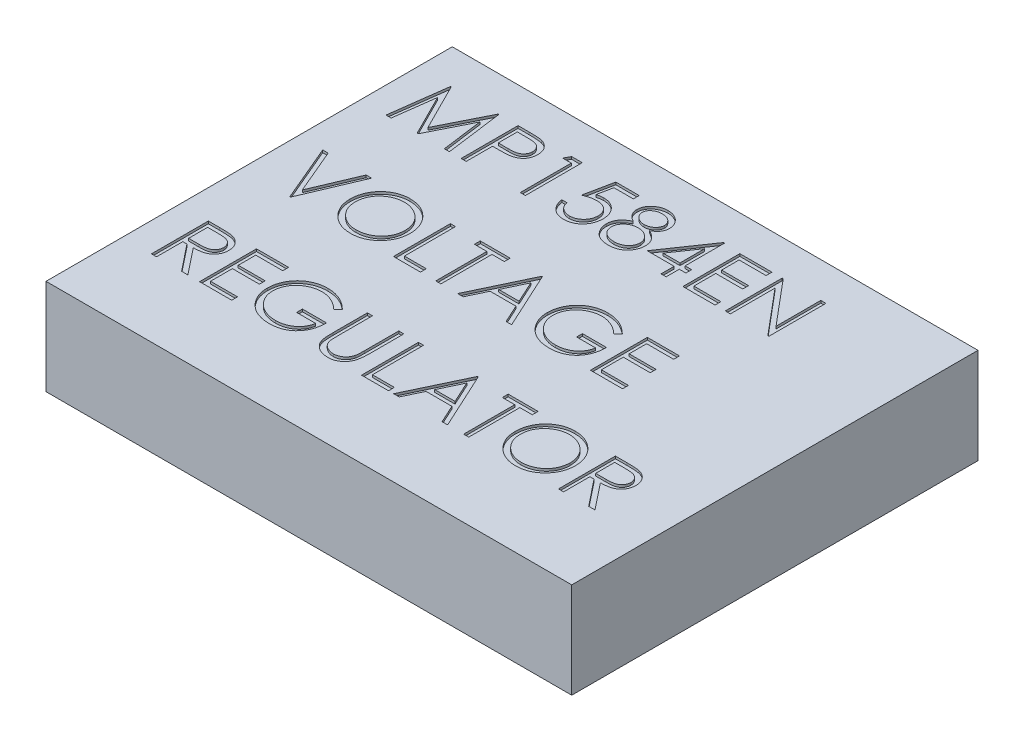
from build123d import *

# Parameters (mm, degrees)
SKETCH1_W           = 22
SKETCH1_H           = 17
BOSS_EXTRUDE1_DEPTH = 4
CUT_EXTRUDE1_DEPTH  = 0.1


with BuildPart() as part:
    # Sketch1 → Boss-Extrude1 (new body)
    with BuildSketch(Plane(origin=(0, 0, 0), x_dir=(1, 0, 0), z_dir=(0, 1, 0))):
        Rectangle(SKETCH1_W, SKETCH1_H)
    extrude(amount=BOSS_EXTRUDE1_DEPTH)

    # Sketch2 → Cut-Extrude1 (cut)
    # profile 1 of 24: a face of its own
    with BuildSketch(Plane(origin=(0, 4, 0), x_dir=(1, 0, 0), z_dir=(0, 1, 0))):
        Polygon((-9.911138642, 4.638266378), (-9.596786929, 7.019516378), (-9.566258083, 7.019516378), (-8.583133834, 5.065670224), (-7.602394651, 7.019516378), (-7.571388792, 7.019516378), (-7.255129026, 4.638266378), (-7.469784976, 4.638266378), (-7.697797296, 6.351697868), (-8.55737512, 4.638266378), (-8.605553455, 4.638266378), (-9.468470372, 6.355513974), (-9.696005679, 4.638266378), align=None)
    # profile 2 of 24: a face of its own
    with BuildSketch(Plane(origin=(0, 4, 0), x_dir=(1, 0, 0), z_dir=(0, 1, 0))):
        with BuildLine():
            Line((-6.766667488, 7.019516378), (-6.299671544, 7.019516378))
            add(Edge.make_bspline(
                [(-6.299671544, 7.019516378), (-6.267551267, 7.01948107), (-6.20600739, 7.019413418), (-6.117754825, 7.017362314), (-6.037602132, 7.014622726), (-5.965722141, 7.010825045), (-5.901893689, 7.006337007), (-5.846405597, 7.000042316), (-5.798821721, 6.993469865), (-5.770310368, 6.986787801), (-5.757307512, 6.983740386)],
                knots=[0, 0, 0, 0, 1.415646017, 2.712440637, 3.8905458, 4.950247383, 5.884950622, 6.709939814, 7.411656543, 8, 8, 8, 8], degree=3))
            add(Edge.make_bspline(
                [(-5.757307512, 6.983740386), (-5.740847268, 6.979235095), (-5.708314646, 6.970330675), (-5.66143733, 6.952495981), (-5.616837303, 6.931349008), (-5.574361546, 6.907248077), (-5.534532021, 6.879159149), (-5.496754483, 6.848220848), (-5.461362318, 6.81371887), (-5.428554549, 6.776040189), (-5.398425071, 6.735817331), (-5.372483269, 6.69244985), (-5.350761352, 6.646667731), (-5.332130948, 6.598502819), (-5.31872216, 6.547550653), (-5.308620966, 6.494165265), (-5.302209533, 6.438352377), (-5.301595469, 6.400211646), (-5.301282872, 6.380795675)],
                knots=[0, 0, 0, 0, 0.999701418, 1.975846123, 2.934577507, 3.890451536, 4.834027766, 5.787354733, 6.749476667, 7.726910423, 8.712836071, 9.690891519, 10.682875813, 11.679750201, 12.712814741, 13.765529915, 14.8625177, 16, 16, 16, 16], degree=3))
            add(Edge.make_bspline(
                [(-5.301282872, 6.380795675), (-5.301569592, 6.361216509), (-5.302130578, 6.322908548), (-5.308863586, 6.266865633), (-5.317932877, 6.213309014), (-5.331878193, 6.162357442), (-5.350142838, 6.114313498), (-5.371568682, 6.068442981), (-5.397411048, 6.025526276), (-5.427105119, 5.985407576), (-5.460137543, 5.948049225), (-5.49636856, 5.913721945), (-5.5356519, 5.882626672), (-5.577862719, 5.854693695), (-5.623412527, 5.830570762), (-5.671610492, 5.808964453), (-5.72287555, 5.790818606), (-5.758351082, 5.781273154), (-5.776388041, 5.776419923)],
                knots=[0, 0, 0, 0, 1.121902311, 2.195077645, 3.232258892, 4.234102512, 5.217864754, 6.176164875, 7.132989551, 8.084763148, 9.034132444, 9.988522005, 10.94243251, 11.903244335, 12.886203696, 13.894208494, 14.929344452, 16, 16, 16, 16], degree=3))
            add(Edge.make_bspline(
                [(-5.776388041, 5.776419923), (-5.791306459, 5.773247431), (-5.82400104, 5.766294729), (-5.877846356, 5.758532904), (-5.940538128, 5.751907858), (-6.011990786, 5.746940477), (-6.092140195, 5.742687994), (-6.181029711, 5.739307916), (-6.278833824, 5.73745064), (-6.347054081, 5.737354851), (-6.382671845, 5.737304839)],
                knots=[0, 0, 0, 0, 0.601384939, 1.31797006, 2.144135048, 3.087295005, 4.142315834, 5.309527816, 6.595305764, 8, 8, 8, 8], degree=3))
            Line((-6.382671845, 5.737304839), (-6.552965565, 5.737304839))
            Line((-6.552965565, 5.737304839), (-6.552965565, 4.638266378))
            Line((-6.552965565, 4.638266378), (-6.766667488, 4.638266378))
            Line((-6.766667488, 4.638266378), (-6.766667488, 7.019516378))
        make_face()
        with BuildLine():
            Line((-6.552965565, 6.775285608), (-6.552965565, 5.981535608))
            Line((-6.552965565, 5.981535608), (-6.136056009, 5.976288463))
            add(Edge.make_bspline(
                [(-6.136056009, 5.976288463), (-6.115699774, 5.976277942), (-6.076402482, 5.976257632), (-6.019636051, 5.978969007), (-5.96697009, 5.982099013), (-5.91856637, 5.986681846), (-5.874403071, 5.993159702), (-5.834406556, 5.999699116), (-5.798886958, 6.009159729), (-5.75731768, 6.021898103), (-5.710996688, 6.043623686), (-5.660604303, 6.075158165), (-5.617897886, 6.115354147), (-5.580942045, 6.160548796), (-5.551614653, 6.210826597), (-5.530145308, 6.264621713), (-5.517530699, 6.321382446), (-5.5158392, 6.360222769), (-5.514984796, 6.379841648)],
                knots=[0, 0, 0, 0, 1.160613943, 2.240541288, 3.23993089, 4.169200891, 5.011653406, 5.7853311, 6.478053781, 7.106038997, 8.262395093, 9.384106736, 10.481365981, 11.59014053, 12.70357646, 13.786202915, 14.881775077, 16, 16, 16, 16], degree=3))
            add(Edge.make_bspline(
                [(-5.514984796, 6.379841648), (-5.515843846, 6.398985887), (-5.517551532, 6.437042264), (-5.530244182, 6.492817099), (-5.551572912, 6.546045319), (-5.581138916, 6.595693079), (-5.617021721, 6.640725105), (-5.658727167, 6.679843686), (-5.706157082, 6.711290952), (-5.750277039, 6.731588238), (-5.789466417, 6.743981131), (-5.823506019, 6.752652174), (-5.861939853, 6.75957522), (-5.904780431, 6.765181025), (-5.951695706, 6.769979897), (-6.003088738, 6.773236071), (-6.058764841, 6.775142062), (-6.097416319, 6.775236601), (-6.117452494, 6.775285608)],
                knots=[0, 0, 0, 0, 1.120700087, 2.227813068, 3.331159281, 4.466773991, 5.599788987, 6.693661531, 7.80175334, 8.91857717, 9.525282508, 10.207424825, 10.974604443, 11.810962634, 12.737642355, 13.736264703, 14.826523623, 16, 16, 16, 16], degree=3))
            Line((-6.117452494, 6.775285608), (-6.552965565, 6.775285608))
        make_face(mode=Mode.SUBTRACT)
    # profile 3 of 24: a face of its own
    with BuildSketch(Plane(origin=(0, 4, 0), x_dir=(1, 0, 0), z_dir=(0, 1, 0))):
        Polygon((-4.520412229, 7.019516378), (-4.080129026, 7.019516378), (-4.080129026, 4.638266378), (-4.293830949, 4.638266378), (-4.293830949, 6.775285608), (-4.660177103, 6.775285608), align=None)
    # profile 4 of 24: a face of its own
    with BuildSketch(Plane(origin=(0, 4, 0), x_dir=(1, 0, 0), z_dir=(0, 1, 0))):
        with BuildLine():
            Line((-1.698879026, 7.019516378), (-1.698879026, 6.775285608))
            Line((-1.698879026, 6.775285608), (-2.508847476, 6.775285608))
            Line((-2.508847476, 6.775285608), (-2.637164032, 6.148967249))
            add(Edge.make_bspline(
                [(-2.637164032, 6.148967249), (-2.611952804, 6.155927488), (-2.563110035, 6.169411849), (-2.491019487, 6.184383632), (-2.422580863, 6.193408872), (-2.378170298, 6.19464121), (-2.356680258, 6.195237532)],
                knots=[0, 0, 0, 0, 1.100273476, 2.13160584, 3.095893838, 4, 4, 4, 4], degree=3))
            add(Edge.make_bspline(
                [(-2.356680258, 6.195237532), (-2.330089357, 6.194661993), (-2.277805001, 6.193530341), (-2.20130636, 6.182663779), (-2.128281659, 6.165559659), (-2.058883618, 6.141665161), (-1.992983851, 6.111110503), (-1.931188671, 6.072942508), (-1.872570519, 6.028356438), (-1.818181004, 5.977094921), (-1.768838573, 5.920678607), (-1.725454927, 5.860019412), (-1.688605021, 5.795706842), (-1.658968151, 5.727126428), (-1.63530238, 5.655036361), (-1.619550755, 5.578678122), (-1.609061887, 5.498771454), (-1.60789005, 5.444135667), (-1.607292488, 5.416274941)],
                knots=[0, 0, 0, 0, 1.052922333, 2.070308379, 3.05430497, 4.020497103, 4.973039431, 5.925935799, 6.892292201, 7.88610001, 8.88166317, 9.857072816, 10.836096531, 11.812156883, 12.81219415, 13.836441305, 14.89672472, 16, 16, 16, 16], degree=3))
            add(Edge.make_bspline(
                [(-1.607292488, 5.416274941), (-1.607744977, 5.396869645), (-1.608643839, 5.358321298), (-1.613214878, 5.30107319), (-1.622015785, 5.245037048), (-1.63383204, 5.190205439), (-1.649168935, 5.13668217), (-1.667735238, 5.084314041), (-1.690456464, 5.033426996), (-1.715378882, 4.98353954), (-1.743441218, 4.935779484), (-1.774586952, 4.891114727), (-1.807492759, 4.848875243), (-1.842899488, 4.809514042), (-1.881136236, 4.773289775), (-1.921739928, 4.739987462), (-1.964386564, 4.709043914), (-2.009735934, 4.681715195), (-2.056777516, 4.656567184), (-2.106190642, 4.635936349), (-2.156850512, 4.617491507), (-2.209486257, 4.602789311), (-2.263978655, 4.591269126), (-2.320417529, 4.583444611), (-2.378506878, 4.577745642), (-2.417882556, 4.577388892), (-2.437772506, 4.577208685)],
                knots=[0, 0, 0, 0, 1.056347294, 2.098418968, 3.122841568, 4.141288669, 5.149314143, 6.15115421, 7.162517403, 8.180376062, 9.185164535, 10.17417709, 11.141909838, 12.097768115, 13.052685741, 14.0056014, 14.954263652, 15.917497458, 16.885230207, 17.854509472, 18.828990115, 19.81800267, 20.826176721, 21.857883937, 22.917946725, 24, 24, 24, 24], degree=3))
            add(Edge.make_bspline(
                [(-2.437772506, 4.577208685), (-2.461499404, 4.577678702), (-2.508179273, 4.578603404), (-2.576569158, 4.588277052), (-2.642369631, 4.602131788), (-2.705051004, 4.622975393), (-2.765175024, 4.649092463), (-2.821932266, 4.682100787), (-2.876772981, 4.719506213), (-2.927467778, 4.763648025), (-2.974518634, 4.811896015), (-3.016637169, 4.864254696), (-3.054147692, 4.919859906), (-3.086449516, 4.978981686), (-3.114002634, 5.041464686), (-3.135648189, 5.107543014), (-3.153118641, 5.176871409), (-3.160509647, 5.224600851), (-3.164263642, 5.248843301)],
                knots=[0, 0, 0, 0, 1.0467383, 2.05933395, 3.04377827, 4.011590433, 4.970194871, 5.932262533, 6.905835911, 7.896367577, 8.894135286, 9.877477877, 10.858688626, 11.851381753, 12.8477658, 13.868841284, 14.917554742, 16, 16, 16, 16], degree=3))
            Line((-3.164263642, 5.248843301), (-2.950561719, 5.248843301))
            add(Edge.make_bspline(
                [(-2.950561719, 5.248843301), (-2.945303539, 5.226135393), (-2.935197027, 5.182489533), (-2.913013473, 5.121168031), (-2.88589044, 5.066522274), (-2.853638553, 5.017829397), (-2.815164336, 4.97536899), (-2.771261278, 4.937529524), (-2.722038987, 4.903392517), (-2.667342879, 4.874938098), (-2.609639695, 4.850670607), (-2.54924629, 4.834510972), (-2.487807083, 4.8231484), (-2.446251977, 4.822011006), (-2.425370162, 4.821439455)],
                knots=[0, 0, 0, 0, 1.136247022, 2.183929868, 3.172523383, 4.106158343, 5.02341133, 5.958108904, 6.928429099, 7.938127109, 8.96079061, 9.975095812, 10.982467395, 12, 12, 12, 12], degree=3))
            add(Edge.make_bspline(
                [(-2.425370162, 4.821439455), (-2.40498772, 4.821997877), (-2.364854526, 4.823097414), (-2.305791779, 4.831560385), (-2.248769091, 4.844594376), (-2.194349122, 4.864100116), (-2.141579574, 4.887806969), (-2.091795277, 4.918229191), (-2.043555998, 4.953240382), (-1.998361143, 4.993351946), (-1.956968589, 5.037554542), (-1.920395228, 5.084823983), (-1.889930935, 5.135249909), (-1.864258265, 5.187959322), (-1.844763788, 5.243529911), (-1.830856621, 5.301701247), (-1.822690254, 5.36261701), (-1.821566862, 5.404165951), (-1.820994411, 5.425338193)],
                knots=[0, 0, 0, 0, 1.027316725, 2.022795036, 3.002884548, 3.971462791, 4.93288096, 5.914575861, 6.907176829, 7.935150275, 8.956128384, 9.956726525, 10.942570165, 11.921478529, 12.907843606, 13.90538589, 14.932640048, 16, 16, 16, 16], degree=3))
            add(Edge.make_bspline(
                [(-1.820994411, 5.425338193), (-1.821442412, 5.444439731), (-1.822319311, 5.481828274), (-1.829483859, 5.536528448), (-1.841945942, 5.588285286), (-1.859243261, 5.63734872), (-1.881204854, 5.683765026), (-1.908042435, 5.727582108), (-1.940259657, 5.768222449), (-1.97706146, 5.805705061), (-2.017378091, 5.840297735), (-2.061903209, 5.869787194), (-2.109705052, 5.89459568), (-2.16020769, 5.916005158), (-2.21461238, 5.931381736), (-2.271841732, 5.942925958), (-2.332513742, 5.949603911), (-2.373995586, 5.950530481), (-2.395318329, 5.951006762)],
                knots=[0, 0, 0, 0, 1.045622112, 2.046656509, 3.013763289, 3.955457236, 4.890082067, 5.820317437, 6.762574623, 7.722996705, 8.69280354, 9.665887285, 10.63943826, 11.638615906, 12.663482002, 13.728887084, 14.832589034, 16, 16, 16, 16], degree=3))
            add(Edge.make_bspline(
                [(-2.395318329, 5.951006762), (-2.41377569, 5.950611753), (-2.451885456, 5.949796159), (-2.510343665, 5.943790989), (-2.571774284, 5.934103183), (-2.635941825, 5.92077754), (-2.703038992, 5.903339254), (-2.772924189, 5.882442424), (-2.845744357, 5.85745835), (-2.894810166, 5.83859054), (-2.920032872, 5.828891378)],
                knots=[0, 0, 0, 0, 0.817624296, 1.688186739, 2.600797293, 3.572016777, 4.590301741, 5.671205678, 6.80286297, 8, 8, 8, 8], degree=3))
            Line((-2.920032872, 5.828891378), (-2.675802103, 7.019516378))
            Line((-2.675802103, 7.019516378), (-1.698879026, 7.019516378))
        make_face()
    # profile 5 of 24: a face of its own
    with BuildSketch(Plane(origin=(0, 4, 0), x_dir=(1, 0, 0), z_dir=(0, 1, 0))):
        with BuildLine():
            add(Edge.make_bspline(
                [(-0.205350631, 5.964840146), (-0.185859387, 5.954677001), (-0.147844953, 5.934855474), (-0.093704031, 5.902939357), (-0.044225056, 5.869301843), (0.001964772, 5.835531732), (0.044053945, 5.800335733), (0.08157184, 5.76357389), (0.115445203, 5.726163809), (0.144990925, 5.687472007), (0.170978416, 5.647601276), (0.193438458, 5.606446967), (0.212636234, 5.56409927), (0.227851019, 5.520095927), (0.240384416, 5.475083321), (0.249008355, 5.428480229), (0.253646293, 5.38059374), (0.254523147, 5.348230306), (0.254967128, 5.331843601)],
                knots=[0, 0, 0, 0, 1.272397273, 2.481599622, 3.635517121, 4.734568067, 5.792894095, 6.808321871, 7.773003508, 8.711915296, 9.623354172, 10.525449501, 11.423591555, 12.311487226, 13.218079475, 14.126165749, 15.051214107, 16, 16, 16, 16], degree=3))
            add(Edge.make_bspline(
                [(0.254967128, 5.331843601), (0.254442286, 5.308917108), (0.253403428, 5.263536976), (0.244354689, 5.196558461), (0.230806752, 5.131508302), (0.211022298, 5.068400761), (0.185363723, 5.007584062), (0.153742876, 4.949006147), (0.117948466, 4.891706938), (0.089201854, 4.856451238), (0.07465613, 4.838611931)],
                knots=[0, 0, 0, 0, 1.025265484, 2.029385089, 3.018602448, 3.995076438, 4.983346944, 5.966715145, 6.97116228, 8, 8, 8, 8], degree=3))
            add(Edge.make_bspline(
                [(0.07465613, 4.838611931), (0.055717386, 4.817797238), (0.018073929, 4.776425065), (-0.046412313, 4.722710318), (-0.117184345, 4.677569033), (-0.193968317, 4.640780834), (-0.276558981, 4.612147419), (-0.364938738, 4.591571706), (-0.459279885, 4.579786267), (-0.524121643, 4.57808266), (-0.557386388, 4.577208685)],
                knots=[0, 0, 0, 0, 0.954267603, 1.896743057, 2.838368354, 3.796610408, 4.779680527, 5.799409237, 6.871065594, 8, 8, 8, 8], degree=3))
            add(Edge.make_bspline(
                [(-0.557386388, 4.577208685), (-0.589372283, 4.577992782), (-0.651613585, 4.579518554), (-0.742208498, 4.589856194), (-0.826656515, 4.607972654), (-0.905448655, 4.632768004), (-0.978109908, 4.665023891), (-1.044433233, 4.705170684), (-1.105375524, 4.751592433), (-1.159087322, 4.805622368), (-1.206772495, 4.863492099), (-1.24866076, 4.923194534), (-1.28347741, 4.984735122), (-1.312955308, 5.047196239), (-1.33552141, 5.111453355), (-1.351150717, 5.177175864), (-1.361076661, 5.24424897), (-1.362397326, 5.289514255), (-1.363061719, 5.312286059)],
                knots=[0, 0, 0, 0, 1.256902934, 2.445805442, 3.576955095, 4.645999104, 5.686449165, 6.692658513, 7.68621702, 8.689161843, 9.678783111, 10.630372946, 11.551080876, 12.453998257, 13.34127905, 14.221779781, 15.105423033, 16, 16, 16, 16], degree=3))
            add(Edge.make_bspline(
                [(-1.363061719, 5.312286059), (-1.362668553, 5.328995081), (-1.361891519, 5.362018005), (-1.356513399, 5.410805959), (-1.347867107, 5.458292258), (-1.336124512, 5.5046523), (-1.32021026, 5.549548573), (-1.300995523, 5.593193806), (-1.278590034, 5.635637273), (-1.252681242, 5.677111083), (-1.222540043, 5.717034108), (-1.188410846, 5.756083883), (-1.149611528, 5.793654475), (-1.106573728, 5.830204911), (-1.059789282, 5.866383564), (-1.008042998, 5.90023523), (-0.952706648, 5.934156452), (-0.913378327, 5.954436759), (-0.893203696, 5.964840146)],
                knots=[0, 0, 0, 0, 0.941657376, 1.861047343, 2.762797495, 3.66048619, 4.553285746, 5.444104102, 6.34607688, 7.256116206, 8.197091036, 9.162375105, 10.176350973, 11.237807142, 12.343728897, 13.50695164, 14.721116704, 16, 16, 16, 16], degree=3))
            add(Edge.make_bspline(
                [(-0.893203696, 5.964840146), (-0.920820327, 5.979899694), (-0.974293856, 6.009059194), (-1.045098244, 6.062635146), (-1.105915793, 6.12066132), (-1.155074806, 6.184363019), (-1.193768233, 6.251750268), (-1.220314819, 6.322401447), (-1.238273856, 6.395006517), (-1.240052872, 6.444608768), (-1.240946334, 6.469520134)],
                knots=[0, 0, 0, 0, 1.166880483, 2.259407225, 3.286803203, 4.280235371, 5.237608625, 6.161067461, 7.076446754, 8, 8, 8, 8], degree=3))
            add(Edge.make_bspline(
                [(-1.240946334, 6.469520134), (-1.239833662, 6.494895794), (-1.237596996, 6.545905297), (-1.219510844, 6.62183732), (-1.190037727, 6.696415733), (-1.149950406, 6.769279066), (-1.100020889, 6.837961266), (-1.040117793, 6.899561445), (-0.971671621, 6.953521579), (-0.895024037, 6.998817153), (-0.812540098, 7.035681393), (-0.725511721, 7.06111207), (-0.635455232, 7.077737356), (-0.574156605, 7.079619669), (-0.543075991, 7.08057407)],
                knots=[0, 0, 0, 0, 0.888701115, 1.786444228, 2.72001202, 3.692817113, 4.693886446, 5.687152267, 6.695133018, 7.739871481, 8.800368666, 9.853104506, 10.91144658, 12, 12, 12, 12], degree=3))
            add(Edge.make_bspline(
                [(-0.543075991, 7.08057407), (-0.512797503, 7.07959004), (-0.453091773, 7.077649645), (-0.365329357, 7.061466073), (-0.28135636, 7.03443581), (-0.201462362, 6.99776645), (-0.127077645, 6.95259962), (-0.061353574, 6.897898311), (-0.003296942, 6.836569863), (0.044725655, 6.76790849), (0.084297192, 6.695325137), (0.111852269, 6.619381958), (0.12950888, 6.54171983), (0.131735937, 6.489170403), (0.132851743, 6.462841949)],
                knots=[0, 0, 0, 0, 1.072916533, 2.115669174, 3.151510826, 4.193348718, 5.225979165, 6.227137561, 7.216255879, 8.211077061, 9.189680878, 10.138522389, 11.067357538, 12, 12, 12, 12], degree=3))
            add(Edge.make_bspline(
                [(0.132851743, 6.462841949), (0.131875729, 6.437004254), (0.129958894, 6.386260491), (0.113834471, 6.312287626), (0.086679163, 6.243012274), (0.04960367, 6.177648355), (0.001280972, 6.1173813), (-0.057643898, 6.061444738), (-0.126701154, 6.009379164), (-0.178585792, 5.979997012), (-0.205350631, 5.964840146)],
                knots=[0, 0, 0, 0, 0.975232327, 1.915300861, 2.843280834, 3.77672583, 4.742871857, 5.749627742, 6.839139064, 8, 8, 8, 8], degree=3))
        make_face()
        with BuildLine():
            add(Edge.make_bspline(
                [(-0.555001322, 6.836343301), (-0.571704638, 6.835900089), (-0.604383628, 6.835032972), (-0.652300277, 6.83050272), (-0.697865406, 6.821689907), (-0.741555085, 6.809961426), (-0.782770312, 6.794117277), (-0.82207084, 6.775478887), (-0.858787803, 6.752818867), (-0.893364439, 6.72739991), (-0.924491305, 6.699442057), (-0.952116902, 6.670313438), (-0.975064065, 6.639441966), (-0.994550249, 6.607595564), (-1.008689103, 6.573829047), (-1.019278388, 6.539177657), (-1.026436692, 6.503203512), (-1.026973079, 6.478617779), (-1.027244411, 6.466181041)],
                knots=[0, 0, 0, 0, 1.203892937, 2.355340988, 3.463153438, 4.544400666, 5.610487187, 6.640501085, 7.674077295, 8.714426146, 9.728707835, 10.68524104, 11.601827946, 12.495867327, 13.368432065, 14.231010473, 15.105153427, 16, 16, 16, 16], degree=3))
            add(Edge.make_bspline(
                [(-1.027244411, 6.466181041), (-1.026776756, 6.453743766), (-1.025852602, 6.429165923), (-1.018705364, 6.392871682), (-1.008053111, 6.357206247), (-0.991281857, 6.323017681), (-0.971166174, 6.289120003), (-0.946338938, 6.256360408), (-0.916750867, 6.224624887), (-0.883394698, 6.194183367), (-0.847055776, 6.165677244), (-0.808558418, 6.140930491), (-0.768385784, 6.120224426), (-0.726950626, 6.102991385), (-0.683830647, 6.089595195), (-0.639290064, 6.080091527), (-0.593321392, 6.074184668), (-0.562174247, 6.073479123), (-0.546415084, 6.073122147)],
                knots=[0, 0, 0, 0, 0.873023192, 1.725219244, 2.590779336, 3.480155217, 4.391973325, 5.357036234, 6.360879153, 7.436073238, 8.526419356, 9.601555421, 10.645666583, 11.697338044, 12.750135903, 13.812665442, 14.89329948, 16, 16, 16, 16], degree=3))
            add(Edge.make_bspline(
                [(-0.546415084, 6.073122147), (-0.526174388, 6.073716008), (-0.485892913, 6.074897866), (-0.426511797, 6.085886432), (-0.36877489, 6.10317153), (-0.313299314, 6.126820721), (-0.261521016, 6.156503247), (-0.215365541, 6.192040354), (-0.175226584, 6.232611477), (-0.141521276, 6.277585014), (-0.115388862, 6.325449219), (-0.095044954, 6.373482633), (-0.083165091, 6.422197722), (-0.081615532, 6.454832389), (-0.08085018, 6.470951173)],
                knots=[0, 0, 0, 0, 1.076279235, 2.141928126, 3.20205304, 4.278698113, 5.344010996, 6.36967002, 7.368914609, 8.37248503, 9.349703398, 10.264243087, 11.142681841, 12, 12, 12, 12], degree=3))
            add(Edge.make_bspline(
                [(-0.08085018, 6.470951173), (-0.08121206, 6.482264176), (-0.081930341, 6.504718866), (-0.087849486, 6.537878361), (-0.097630187, 6.570283488), (-0.110872032, 6.602201947), (-0.128295839, 6.63318591), (-0.148954331, 6.663722439), (-0.174048965, 6.693124593), (-0.202213324, 6.722077564), (-0.234152968, 6.748872766), (-0.269806344, 6.772436739), (-0.308990664, 6.792447645), (-0.351706853, 6.80870053), (-0.397797596, 6.820907736), (-0.447050605, 6.830049251), (-0.499876559, 6.835201672), (-0.536227872, 6.835954504), (-0.555001322, 6.836343301)],
                knots=[0, 0, 0, 0, 0.814439003, 1.616544685, 2.417341072, 3.248991801, 4.09997495, 4.973547432, 5.9003056, 6.880240646, 7.880314356, 8.896779544, 9.951930927, 11.043077905, 12.18215768, 13.381699519, 14.647792085, 16, 16, 16, 16], degree=3))
        make_face(mode=Mode.SUBTRACT)
        with BuildLine():
            add(Edge.make_bspline(
                [(-0.541167939, 5.828891378), (-0.562344589, 5.828514704), (-0.60388801, 5.827775762), (-0.66475067, 5.819550584), (-0.723161485, 5.808100586), (-0.778923513, 5.790730498), (-0.832013207, 5.768145028), (-0.882717968, 5.740975279), (-0.930649897, 5.708858718), (-0.975147109, 5.672203378), (-1.015780303, 5.632702214), (-1.051429861, 5.590886011), (-1.081704067, 5.547531931), (-1.106083475, 5.502089361), (-1.126093957, 5.45552054), (-1.139234291, 5.406665729), (-1.147658277, 5.35646414), (-1.14878946, 5.322337359), (-1.149359796, 5.305130861)],
                knots=[0, 0, 0, 0, 1.140299081, 2.23698856, 3.303958914, 4.344563908, 5.37730929, 6.408454204, 7.439741482, 8.480804886, 9.510774543, 10.48932336, 11.43758569, 12.353841022, 13.263987381, 14.161954604, 15.073269652, 16, 16, 16, 16], degree=3))
            add(Edge.make_bspline(
                [(-1.149359796, 5.305130861), (-1.148432293, 5.283746619), (-1.146592149, 5.241320784), (-1.131993971, 5.17861698), (-1.108565509, 5.117914798), (-1.07589121, 5.059708916), (-1.035432022, 5.00531429), (-0.985679907, 4.957901034), (-0.929726766, 4.915772314), (-0.865679405, 4.881699665), (-0.795719323, 4.85448888), (-0.719865129, 4.835740984), (-0.639205443, 4.823330283), (-0.583511685, 4.822079663), (-0.555001322, 4.821439455)],
                knots=[0, 0, 0, 0, 0.898778495, 1.783155532, 2.693654817, 3.627872908, 4.583023416, 5.533784346, 6.509005473, 7.520592997, 8.575161974, 9.658835044, 10.801527049, 12, 12, 12, 12], degree=3))
            add(Edge.make_bspline(
                [(-0.555001322, 4.821439455), (-0.532719375, 4.821867269), (-0.489306998, 4.822700788), (-0.425975307, 4.830058371), (-0.366209641, 4.84172624), (-0.310125898, 4.85869676), (-0.25709625, 4.879413619), (-0.208019807, 4.906064624), (-0.161634059, 4.936376116), (-0.120224719, 4.97233854), (-0.082510339, 5.010764768), (-0.049626438, 5.051443351), (-0.021080319, 5.093268736), (0.001324492, 5.13718612), (0.019235747, 5.182352931), (0.032110523, 5.229185663), (0.040054519, 5.277827955), (0.04085795, 5.310824645), (0.041265204, 5.327550482)],
                knots=[0, 0, 0, 0, 1.224942928, 2.386581632, 3.501229538, 4.569074225, 5.605009692, 6.626002462, 7.634866581, 8.645888296, 9.63523824, 10.59253846, 11.518950513, 12.414518923, 13.29783783, 14.186679152, 15.080837789, 16, 16, 16, 16], degree=3))
            add(Edge.make_bspline(
                [(0.041265204, 5.327550482), (0.040648904, 5.343795602), (0.039433667, 5.375828139), (0.031720668, 5.423294294), (0.018170759, 5.46915228), (-0.000421631, 5.513953802), (-0.025173679, 5.556791095), (-0.054323492, 5.598780133), (-0.089493955, 5.6387555), (-0.129235382, 5.677027695), (-0.172546211, 5.712416973), (-0.218584036, 5.743723225), (-0.266994482, 5.770088504), (-0.31767511, 5.791530977), (-0.370513384, 5.808395309), (-0.425470443, 5.82017637), (-0.482610628, 5.827591993), (-0.521428317, 5.828453356), (-0.541167939, 5.828891378)],
                knots=[0, 0, 0, 0, 0.917430815, 1.809013306, 2.70690318, 3.612392954, 4.541220862, 5.495268465, 6.494511384, 7.542276156, 8.608045339, 9.649016899, 10.681629292, 11.715607085, 12.752076957, 13.808767841, 14.885711793, 16, 16, 16, 16], degree=3))
        make_face(mode=Mode.SUBTRACT)
    # profile 6 of 24: a face of its own
    with BuildSketch(Plane(origin=(0, 4, 0), x_dir=(1, 0, 0), z_dir=(0, 1, 0))):
        Polygon((1.768530078, 7.08057407), (1.811938281, 7.08057407), (1.811938281, 5.432016378), (2.086697897, 5.432016378), (2.086697897, 5.187785608), (1.811938281, 5.187785608), (1.811938281, 4.638266378), (1.598236358, 4.638266378), (1.598236358, 5.187785608), (0.468669051, 5.187785608), align=None)
        Polygon((1.598236358, 5.432016378), (1.598236358, 6.466181041), (0.888440685, 5.432016378), align=None, mode=Mode.SUBTRACT)
    # profile 7 of 24: a face of its own
    with BuildSketch(Plane(origin=(0, 4, 0), x_dir=(1, 0, 0), z_dir=(0, 1, 0))):
        Polygon((2.514101743, 7.019516378), (3.857370974, 7.019516378), (3.857370974, 6.775285608), (2.727803666, 6.775285608), (2.727803666, 6.042593301), (3.857370974, 6.042593301), (3.857370974, 5.798362532), (2.727803666, 5.798362532), (2.727803666, 4.882497147), (3.857370974, 4.882497147), (3.857370974, 4.638266378), (2.514101743, 4.638266378), align=None)
    # profile 8 of 24: a face of its own
    with BuildSketch(Plane(origin=(0, 4, 0), x_dir=(1, 0, 0), z_dir=(0, 1, 0))):
        Polygon((4.28477482, 4.638266378), (4.28477482, 7.019516378), (4.329614063, 7.019516378), (5.902803666, 5.145331432), (5.902803666, 7.019516378), (6.116505589, 7.019516378), (6.116505589, 4.638266378), (6.067850241, 4.638266378), (4.498476743, 6.508158205), (4.498476743, 4.638266378), align=None)
    # profile 9 of 24: a face of its own
    with BuildSketch(Plane(origin=(0, 4, 0), x_dir=(1, 0, 0), z_dir=(0, 1, 0))):
        Polygon((-9.972196334, 2.050766378), (-9.743229988, 2.050766378), (-8.949479988, 0.174196366), (-8.155729988, 2.050766378), (-7.926763642, 2.050766378), (-8.934215565, -0.330483622), (-8.964744411, -0.330483622), align=None)
    # profile 10 of 24: a face of its own
    with BuildSketch(Plane(origin=(0, 4, 0), x_dir=(1, 0, 0), z_dir=(0, 1, 0))):
        with BuildLine():
            add(Edge.make_bspline(
                [(-6.385056911, 2.11182407), (-6.340964253, 2.110707278), (-6.254362635, 2.108513806), (-6.127084893, 2.091723201), (-6.005576444, 2.062675088), (-5.888847474, 2.023987952), (-5.778294217, 1.972379879), (-5.673084542, 1.910001233), (-5.573468776, 1.8361985), (-5.480789586, 1.751542186), (-5.39597834, 1.659433086), (-5.321257513, 1.561136508), (-5.258635881, 1.457246787), (-5.207210551, 1.348076115), (-5.166866319, 1.233871387), (-5.139026755, 1.114023753), (-5.121243478, 0.989309737), (-5.119164458, 0.904246817), (-5.118109796, 0.861095404)],
                knots=[0, 0, 0, 0, 1.065120563, 2.091984664, 3.0946048, 4.079830382, 5.057816894, 6.036188127, 7.030412546, 8.04752943, 9.064399622, 10.05169764, 11.02544977, 11.989514704, 12.962713494, 13.945757189, 14.957906945, 16, 16, 16, 16], degree=3))
            add(Edge.make_bspline(
                [(-5.118109796, 0.861095404), (-5.119164303, 0.818261856), (-5.12124286, 0.73383197), (-5.139046975, 0.609909377), (-5.166969512, 0.490785171), (-5.2068359, 0.376658217), (-5.258016092, 0.267408125), (-5.3210547, 0.163322358), (-5.395309702, 0.064366794), (-5.47981472, -0.028374501), (-5.571935786, -0.113417423), (-5.670744236, -0.187521158), (-5.774017905, -0.251287036), (-5.88308576, -0.302166643), (-5.996501321, -0.342832896), (-6.115279651, -0.370559239), (-6.238864182, -0.388443816), (-6.323140704, -0.390497485), (-6.365976382, -0.391541315)],
                knots=[0, 0, 0, 0, 1.043624062, 2.057103931, 3.04512605, 4.022047818, 4.998200453, 5.980619268, 6.982898556, 8.009068085, 9.034988726, 10.034168286, 11.015286542, 11.987931943, 12.962482838, 13.94673481, 14.956375938, 16, 16, 16, 16], degree=3))
            add(Edge.make_bspline(
                [(-6.365976382, -0.391541315), (-6.409127571, -0.390487178), (-6.49419005, -0.388409195), (-6.619060783, -0.370596489), (-6.738992605, -0.34274178), (-6.853642547, -0.302934468), (-6.963074544, -0.251487745), (-7.067502618, -0.188755837), (-7.166507609, -0.114319907), (-7.25926869, -0.029842291), (-7.344142699, 0.06212264), (-7.418137917, 0.16066166), (-7.480883931, 0.263841533), (-7.532157913, 0.371948599), (-7.572751054, 0.484460241), (-7.600444868, 0.602126973), (-7.618362721, 0.724277958), (-7.6204275, 0.807446787), (-7.62147518, 0.849647087)],
                knots=[0, 0, 0, 0, 1.053102029, 2.075944431, 3.073151272, 4.055350789, 5.033113405, 6.020478099, 7.024410459, 8.052272461, 9.079885166, 10.07527673, 11.055994387, 12.023226415, 12.992069828, 13.970394897, 14.97016774, 16, 16, 16, 16], degree=3))
            add(Edge.make_bspline(
                [(-7.62147518, 0.849647087), (-7.621111437, 0.877972171), (-7.62038854, 0.934265005), (-7.61168562, 1.017858174), (-7.599057034, 1.100106996), (-7.580958233, 1.180777588), (-7.557287474, 1.259672472), (-7.529357434, 1.337335759), (-7.495244432, 1.412980399), (-7.456681348, 1.486964743), (-7.413640725, 1.558135479), (-7.36610026, 1.625408909), (-7.315729768, 1.689349552), (-7.260509674, 1.74830046), (-7.202259914, 1.803976572), (-7.140035553, 1.855522278), (-7.074216276, 1.903402379), (-7.004518871, 1.946550861), (-6.932660723, 1.985575558), (-6.85858563, 2.019063995), (-6.783299641, 2.047806405), (-6.706450139, 2.071102395), (-6.6282412, 2.089493834), (-6.548502129, 2.102017409), (-6.467296451, 2.110742525), (-6.412588036, 2.111462004), (-6.385056911, 2.11182407)],
                knots=[0, 0, 0, 0, 1.037015668, 2.060948919, 3.074880161, 4.083647147, 5.086022904, 6.090072063, 7.104153813, 8.122640571, 9.144368836, 10.147691507, 11.138137339, 12.123020368, 13.103399296, 14.087645067, 15.080126199, 16.082011238, 17.087798457, 18.072939717, 19.057185487, 20.037253025, 21.01195951, 21.997135196, 22.992090687, 24, 24, 24, 24], degree=3))
        make_face()
        with BuildLine():
            add(Edge.make_bspline(
                [(-6.37456262, 1.867593301), (-6.397160433, 1.867317831), (-6.442140023, 1.866769524), (-6.509008609, 1.859547046), (-6.574997764, 1.849253318), (-6.640121116, 1.834570177), (-6.704106181, 1.814564919), (-6.767549376, 1.791541016), (-6.829872168, 1.763495952), (-6.890868811, 1.73180988), (-6.950002103, 1.696738204), (-7.00580003, 1.657977055), (-7.058407043, 1.616435432), (-7.107694337, 1.572016385), (-7.153517188, 1.52449371), (-7.196777494, 1.474587856), (-7.235741263, 1.420872373), (-7.2714502, 1.364803864), (-7.303405106, 1.306455359), (-7.331820463, 1.24644115), (-7.355064191, 1.184271688), (-7.374020557, 1.120621448), (-7.389736679, 1.055591239), (-7.399692973, 0.988687742), (-7.406994811, 0.920247139), (-7.407511777, 0.873995199), (-7.407773257, 0.850601113)],
                knots=[0, 0, 0, 0, 1.008559885, 2.007477868, 2.99961109, 3.989939068, 4.984837346, 5.991145699, 7.001802488, 8.033829008, 9.059044045, 10.069351652, 11.065060232, 12.050310815, 13.029377138, 14.011219647, 14.996725999, 15.989392538, 16.977580475, 17.965360261, 18.951710183, 19.937753436, 20.929683414, 21.935841486, 22.955955122, 24, 24, 24, 24], degree=3))
            add(Edge.make_bspline(
                [(-7.407773257, 0.850601113), (-7.406905896, 0.816200745), (-7.405199527, 0.748524579), (-7.390260538, 0.649350181), (-7.367249516, 0.554040115), (-7.3333287, 0.463115887), (-7.290908014, 0.375795938), (-7.238502219, 0.292854888), (-7.176413449, 0.214270322), (-7.105885228, 0.140590862), (-7.028785315, 0.073340413), (-6.946916083, 0.014310308), (-6.86115461, -0.03563488), (-6.771277253, -0.076323688), (-6.677763838, -0.108565634), (-6.58001179, -0.130662703), (-6.478672281, -0.145205647), (-6.409595174, -0.146602254), (-6.37456262, -0.147310545)],
                knots=[0, 0, 0, 0, 1.032063989, 2.030389145, 3.003944642, 3.970395727, 4.937377036, 5.913328081, 6.909231446, 7.93887556, 8.970685674, 9.976071282, 10.964166581, 11.944589148, 12.933237628, 13.927779006, 14.949070134, 16, 16, 16, 16], degree=3))
            add(Edge.make_bspline(
                [(-6.37456262, -0.147310545), (-6.351015798, -0.146987033), (-6.304315379, -0.14634541), (-6.234853961, -0.139882917), (-6.166643931, -0.129519806), (-6.099780962, -0.114599128), (-6.034340939, -0.095925225), (-5.970050725, -0.073740324), (-5.907595102, -0.046062576), (-5.846186177, -0.015481917), (-5.787405877, 0.019379691), (-5.731293059, 0.056825289), (-5.67926208, 0.098305725), (-5.630011658, 0.142064809), (-5.584000677, 0.188984855), (-5.541540279, 0.239004863), (-5.502773439, 0.29244056), (-5.467078061, 0.348424024), (-5.435235127, 0.406932189), (-5.407490776, 0.467163987), (-5.383953061, 0.528971106), (-5.364951704, 0.592442694), (-5.350061773, 0.6574582), (-5.339802042, 0.724104678), (-5.332625337, 0.792248802), (-5.3320844, 0.838338818), (-5.331811719, 0.861572417)],
                knots=[0, 0, 0, 0, 1.047197238, 2.076906641, 3.100256066, 4.114471768, 5.12198147, 6.126382909, 7.136867548, 8.15857795, 9.17633901, 10.174870724, 11.156907918, 12.133735059, 13.104061851, 14.077631395, 15.04955518, 16.038496417, 17.029181396, 18.010275684, 18.986308667, 19.968651475, 20.955262928, 21.950658345, 22.966943676, 24, 24, 24, 24], degree=3))
            add(Edge.make_bspline(
                [(-5.331811719, 0.861572417), (-5.332084619, 0.884647073), (-5.332625966, 0.930419903), (-5.339798614, 0.998088781), (-5.350072613, 1.064255698), (-5.364879027, 1.128660893), (-5.383963149, 1.191320782), (-5.407494886, 1.252176516), (-5.435243456, 1.311454806), (-5.467089766, 1.36900914), (-5.502887317, 1.424236953), (-5.542003936, 1.477034308), (-5.585115004, 1.526409691), (-5.630988781, 1.573582046), (-5.680771116, 1.617545288), (-5.734236502, 1.658314003), (-5.790735861, 1.69687207), (-5.850557784, 1.731655711), (-5.912296081, 1.763778252), (-5.975646827, 1.791299381), (-6.03989234, 1.814684698), (-6.104869245, 1.834630704), (-6.171124449, 1.849195811), (-6.238210269, 1.859556323), (-6.306033887, 1.866767011), (-6.351647221, 1.867316997), (-6.37456262, 1.867593301)],
                knots=[0, 0, 0, 0, 1.02996197, 2.043119294, 3.035359645, 4.018872909, 4.991431989, 5.957985074, 6.929999688, 7.912076566, 8.892894881, 9.867085534, 10.843653904, 11.817741046, 12.803660682, 13.806313499, 14.818574707, 15.856120519, 16.894564902, 17.924820532, 18.937903209, 19.946497019, 20.957711757, 21.963978472, 22.977135795, 24, 24, 24, 24], degree=3))
        make_face(mode=Mode.SUBTRACT)
    # profile 11 of 24: a face of its own
    with BuildSketch(Plane(origin=(0, 4, 0), x_dir=(1, 0, 0), z_dir=(0, 1, 0))):
        Polygon((-4.629648257, 2.050766378), (-4.415946334, 2.050766378), (-4.415946334, -0.086252853), (-3.500080949, -0.086252853), (-3.500080949, -0.330483622), (-4.629648257, -0.330483622), align=None)
    # profile 12 of 24: a face of its own
    with BuildSketch(Plane(origin=(0, 4, 0), x_dir=(1, 0, 0), z_dir=(0, 1, 0))):
        Polygon((-3.377965565, 1.806535608), (-3.377965565, 2.050766378), (-2.126282872, 2.050766378), (-2.126282872, 1.806535608), (-2.645273257, 1.806535608), (-2.645273257, -0.330483622), (-2.85897518, -0.330483622), (-2.85897518, 1.806535608), align=None)
    # profile 13 of 24: a face of its own
    with BuildSketch(Plane(origin=(0, 4, 0), x_dir=(1, 0, 0), z_dir=(0, 1, 0))):
        Polygon((-0.783013642, 2.050766378), (0.31602482, -0.330483622), (0.083719381, -0.330483622), (-0.268316376, 0.432737532), (-1.347797296, 0.432737532), (-1.70985033, -0.330483622), (-1.943109796, -0.330483622), (-0.813542488, 2.050766378), align=None)
        Polygon((-0.800663131, 1.586632514), (-1.231883083, 0.676968301), (-0.380891496, 0.676968301), align=None, mode=Mode.SUBTRACT)
    # profile 14 of 24: a face of its own
    with BuildSketch(Plane(origin=(0, 4, 0), x_dir=(1, 0, 0), z_dir=(0, 1, 0))):
        with BuildLine():
            Line((2.972034435, 1.644351113), (2.788861358, 1.470718301))
            add(Edge.make_bspline(
                [(2.788861358, 1.470718301), (2.755715115, 1.501899656), (2.690213019, 1.563518829), (2.583423997, 1.643468274), (2.472006238, 1.711957174), (2.356541129, 1.767682667), (2.239888077, 1.812145884), (2.123595463, 1.843801637), (2.008856156, 1.86398956), (1.932542388, 1.866403718), (1.894938582, 1.867593301)],
                knots=[0, 0, 0, 0, 1.08915593, 2.152340314, 3.188132944, 4.216796309, 5.218260357, 6.173443236, 7.099959455, 8, 8, 8, 8], degree=3))
            add(Edge.make_bspline(
                [(1.894938582, 1.867593301), (1.871864474, 1.867311901), (1.825776101, 1.866749831), (1.757317242, 1.859575999), (1.689576369, 1.849258476), (1.622681359, 1.834330162), (1.556502145, 1.81541007), (1.491268895, 1.791743532), (1.426859923, 1.764151482), (1.363881929, 1.732268263), (1.302826336, 1.697243582), (1.245161418, 1.6584302), (1.190519623, 1.617072112), (1.139927976, 1.572133857), (1.093095465, 1.524022493), (1.048907377, 1.473632994), (1.008917824, 1.419588675), (0.97279687, 1.362883883), (0.940574055, 1.304514554), (0.912129239, 1.245042503), (0.888250684, 1.184664987), (0.869357537, 1.123306245), (0.85377011, 1.061440969), (0.842804381, 0.998640793), (0.836622165, 0.934838475), (0.835552793, 0.892113912), (0.835015204, 0.870635669)],
                knots=[0, 0, 0, 0, 1.02818874, 2.053710826, 3.065248034, 4.081641283, 5.106893873, 6.131558223, 7.173050175, 8.228653731, 9.27666206, 10.308777013, 11.325269123, 12.329503258, 13.32196095, 14.316845687, 15.314881793, 16.315733098, 17.311955233, 18.285320748, 19.252783886, 20.203351036, 21.145449891, 22.095197417, 23.042428769, 24, 24, 24, 24], degree=3))
            add(Edge.make_bspline(
                [(0.835015204, 0.870635669), (0.835529363, 0.848679988), (0.836556275, 0.804828579), (0.843128743, 0.739382255), (0.855326349, 0.674907936), (0.871632951, 0.61119376), (0.892030613, 0.548130608), (0.917457374, 0.485991882), (0.947573791, 0.424779884), (0.982432945, 0.365046148), (1.02065963, 0.306859948), (1.063483405, 0.252050702), (1.10897248, 0.199888552), (1.15878408, 0.151531648), (1.211320947, 0.105686533), (1.268152728, 0.063616294), (1.328161902, 0.024510574), (1.391440023, -0.011137772), (1.457300487, -0.042984293), (1.524830528, -0.071303408), (1.594245881, -0.0946256), (1.665181747, -0.113633489), (1.737553562, -0.12921387), (1.811728685, -0.139237218), (1.887161724, -0.146510801), (1.938010686, -0.147042616), (1.963628486, -0.147310545)],
                knots=[0, 0, 0, 0, 0.93586088, 1.869166235, 2.799637598, 3.729985548, 4.670839027, 5.622275134, 6.589130586, 7.576015415, 8.568469353, 9.55398029, 10.53834874, 11.515998671, 12.510579167, 13.508179873, 14.527009472, 15.561807829, 16.601455013, 17.643573243, 18.680854198, 19.719860599, 20.772568776, 21.833555941, 22.908541556, 24, 24, 24, 24], degree=3))
            add(Edge.make_bspline(
                [(1.963628486, -0.147310545), (1.994501968, -0.146665175), (2.055127068, -0.145397885), (2.144244629, -0.135532509), (2.229835647, -0.120124601), (2.311659618, -0.097559947), (2.389811576, -0.068778339), (2.464578024, -0.034083264), (2.535370313, 0.007856032), (2.602401258, 0.055191109), (2.664148557, 0.107928879), (2.719838595, 0.164836982), (2.768583116, 0.225639184), (2.811108634, 0.289977372), (2.846288987, 0.358384089), (2.875165245, 0.4305241), (2.897299503, 0.506429853), (2.906385655, 0.558879696), (2.910976743, 0.585381762)],
                knots=[0, 0, 0, 0, 1.13008108, 2.219097802, 3.278683437, 4.311054135, 5.322181354, 6.324827112, 7.324222904, 8.330512327, 9.32562643, 10.293043162, 11.24128371, 12.174520618, 13.111833804, 14.052305215, 15.015860969, 16, 16, 16, 16], degree=3))
            Line((2.910976743, 0.585381762), (2.117226743, 0.585381762))
            Line((2.117226743, 0.585381762), (2.117226743, 0.829612532))
            Line((2.117226743, 0.829612532), (3.124678666, 0.829612532))
            add(Edge.make_bspline(
                [(3.124678666, 0.829612532), (3.12351808, 0.784091544), (3.121246603, 0.694998747), (3.105313377, 0.56507076), (3.079584642, 0.44235359), (3.04443718, 0.326718), (2.998938106, 0.218327859), (2.943575725, 0.117073118), (2.877463978, 0.023607912), (2.802957767, -0.062830785), (2.719341903, -0.139935124), (2.628875752, -0.207702736), (2.531409851, -0.264786479), (2.427036392, -0.311228108), (2.316097062, -0.347473451), (2.198335146, -0.373171613), (2.073910343, -0.388568071), (1.98863664, -0.390535241), (1.94502497, -0.391541315)],
                knots=[0, 0, 0, 0, 1.140356446, 2.231883559, 3.274166699, 4.278491846, 5.25512956, 6.21435461, 7.1637429, 8.11826594, 9.068280886, 10.0076534, 10.945064095, 11.891975133, 12.864533718, 13.863980011, 14.907571808, 16, 16, 16, 16], degree=3))
            add(Edge.make_bspline(
                [(1.94502497, -0.391541315), (1.918143967, -0.391154109), (1.865125966, -0.390390414), (1.786823031, -0.384962969), (1.710679079, -0.376607791), (1.636705201, -0.363990484), (1.564629293, -0.348536407), (1.494811326, -0.32874705), (1.426985337, -0.30584031), (1.361046493, -0.279785575), (1.297593293, -0.249597001), (1.236343109, -0.216048836), (1.17695737, -0.179314067), (1.119840595, -0.138757403), (1.064695184, -0.094682193), (1.011876717, -0.047000098), (0.9610895, 0.00414311), (0.929275684, 0.0404599), (0.913245373, 0.058759166)],
                knots=[0, 0, 0, 0, 1.107784379, 2.184907829, 3.233506516, 4.263428166, 5.276301166, 6.270063455, 7.25232949, 8.225834625, 9.190232166, 10.146266622, 11.1027726, 12.066435141, 13.031522626, 14.010570082, 14.99756817, 16, 16, 16, 16], degree=3))
            add(Edge.make_bspline(
                [(0.913245373, 0.058759166), (0.88998673, 0.08779045), (0.843855513, 0.145371128), (0.784475196, 0.237627518), (0.73385567, 0.333150927), (0.692783991, 0.432207272), (0.660713257, 0.534703901), (0.637712932, 0.64050984), (0.624236901, 0.749761339), (0.622295477, 0.823692528), (0.621313281, 0.861095404)],
                knots=[0, 0, 0, 0, 1.023165419, 2.029347347, 3.013907458, 3.994755782, 4.975994455, 5.96558838, 6.970761222, 8, 8, 8, 8], degree=3))
            add(Edge.make_bspline(
                [(0.621313281, 0.861095404), (0.621675393, 0.889103158), (0.622395015, 0.944762705), (0.631120947, 1.027397052), (0.643640483, 1.10856413), (0.66204214, 1.18819759), (0.685239777, 1.266350618), (0.714191345, 1.3430595), (0.747899569, 1.418369506), (0.787078273, 1.491762263), (0.830678592, 1.562263872), (0.877997582, 1.62959052), (0.929707174, 1.692516116), (0.984962923, 1.751837577), (1.04442409, 1.80680965), (1.107533626, 1.857941286), (1.174340168, 1.905301073), (1.245053891, 1.94814305), (1.318619333, 1.986626513), (1.394860156, 2.020364887), (1.473753085, 2.048248179), (1.554707065, 2.071906768), (1.638334865, 2.089402248), (1.724029614, 2.102090055), (1.812237994, 2.11077182), (1.871861792, 2.11147004), (1.90209378, 2.11182407)],
                knots=[0, 0, 0, 0, 1.008945113, 2.00506715, 2.99143336, 3.967273523, 4.948097931, 5.927297278, 6.919902385, 7.919676788, 8.923139349, 9.905703106, 10.883022732, 11.856032218, 12.825136022, 13.798837087, 14.781400844, 15.773989409, 16.776158564, 17.77167057, 18.775803737, 19.789618931, 20.80898985, 21.851988756, 22.910860228, 24, 24, 24, 24], degree=3))
            add(Edge.make_bspline(
                [(1.90209378, 2.11182407), (1.926748728, 2.111429809), (1.975636593, 2.110648035), (2.048384278, 2.10522923), (2.120007526, 2.096640482), (2.190612534, 2.084920115), (2.259958865, 2.068956425), (2.32824407, 2.049853164), (2.395567135, 2.027611049), (2.461717069, 2.001084709), (2.527138658, 1.970976439), (2.59219566, 1.937085521), (2.65666579, 1.898832437), (2.72066085, 1.856103603), (2.784584389, 1.809632885), (2.847425334, 1.758091189), (2.910700551, 1.703511064), (2.951387142, 1.664266578), (2.972034435, 1.644351113)],
                knots=[0, 0, 0, 0, 0.985871117, 1.954866573, 2.915460327, 3.869826059, 4.81536089, 5.759505086, 6.70452669, 7.649098992, 8.607881297, 9.583363685, 10.581137262, 11.603961102, 12.659522466, 13.73993555, 14.853081303, 16, 16, 16, 16], degree=3))
        make_face()
    # profile 15 of 24: a face of its own
    with BuildSketch(Plane(origin=(0, 4, 0), x_dir=(1, 0, 0), z_dir=(0, 1, 0))):
        Polygon((3.613140204, 2.050766378), (4.956409435, 2.050766378), (4.956409435, 1.806535608), (3.826842128, 1.806535608), (3.826842128, 1.073843301), (4.956409435, 1.073843301), (4.956409435, 0.829612532), (3.826842128, 0.829612532), (3.826842128, -0.086252853), (4.956409435, -0.086252853), (4.956409435, -0.330483622), (3.613140204, -0.330483622), align=None)
    # profile 16 of 24: a face of its own
    with BuildSketch(Plane(origin=(0, 4, 0), x_dir=(1, 0, 0), z_dir=(0, 1, 0))):
        with BuildLine():
            Line((-9.789023257, -2.917983622), (-9.312487049, -2.917983622))
            add(Edge.make_bspline(
                [(-9.312487049, -2.917983622), (-9.280686388, -2.918089476), (-9.219625597, -2.918292728), (-9.132149855, -2.919426041), (-9.052665705, -2.922674308), (-8.981214707, -2.925469613), (-8.917798172, -2.930566808), (-8.86222164, -2.935438606), (-8.814741082, -2.941816043), (-8.785998815, -2.94773884), (-8.772985096, -2.950420521)],
                knots=[0, 0, 0, 0, 1.410062039, 2.707475311, 3.878576406, 4.937260626, 5.877586885, 6.699081471, 7.410979367, 8, 8, 8, 8], degree=3))
            add(Edge.make_bspline(
                [(-8.772985096, -2.950420521), (-8.755563446, -2.954724981), (-8.721091798, -2.963242076), (-8.6714597, -2.981244054), (-8.624165133, -3.002076334), (-8.579404556, -3.026544508), (-8.537402169, -3.054830207), (-8.49772489, -3.086445126), (-8.460192673, -3.121216278), (-8.426323385, -3.16002034), (-8.394388066, -3.200730537), (-8.367453661, -3.2447522), (-8.344235467, -3.290786203), (-8.325749812, -3.339300714), (-8.310864976, -3.389825241), (-8.300369624, -3.44281744), (-8.294075513, -3.49803589), (-8.293434715, -3.535699038), (-8.293109796, -3.554796273)],
                knots=[0, 0, 0, 0, 1.027469482, 2.033020251, 3.019912614, 3.986113645, 4.951240523, 5.91722682, 6.890402269, 7.87763091, 8.8651537, 9.85103654, 10.82876324, 11.815024772, 12.821070561, 13.842952187, 14.906261191, 16, 16, 16, 16], degree=3))
            add(Edge.make_bspline(
                [(-8.293109796, -3.554796273), (-8.294109239, -3.586524799), (-8.296059412, -3.648435372), (-8.314242027, -3.738283936), (-8.344025695, -3.822096666), (-8.385067075, -3.899768032), (-8.437331754, -3.969784025), (-8.500145585, -4.031281817), (-8.57354361, -4.082743972), (-8.641871413, -4.118430612), (-8.702228752, -4.141285787), (-8.751917488, -4.157366953), (-8.806119486, -4.169791612), (-8.864315422, -4.180922344), (-8.926747481, -4.189325908), (-8.993266025, -4.195480823), (-9.063918496, -4.199327595), (-9.112454542, -4.199900459), (-9.137423197, -4.200195161)],
                knots=[0, 0, 0, 0, 1.260483769, 2.459530307, 3.627416485, 4.787058657, 5.939039949, 7.08810263, 8.267026773, 9.491475466, 10.141966685, 10.831826277, 11.566392101, 12.351337768, 13.187381173, 14.07005841, 15.007169909, 16, 16, 16, 16], degree=3))
            Line((-9.137423197, -4.200195161), (-8.262580949, -5.299233622))
            Line((-8.262580949, -5.299233622), (-8.526846274, -5.299233622))
            Line((-8.526846274, -5.299233622), (-9.401688522, -4.200195161))
            Line((-9.401688522, -4.200195161), (-9.575321334, -4.200195161))
            Line((-9.575321334, -4.200195161), (-9.575321334, -5.299233622))
            Line((-9.575321334, -5.299233622), (-9.789023257, -5.299233622))
            Line((-9.789023257, -5.299233622), (-9.789023257, -2.917983622))
        make_face()
        with BuildLine():
            Line((-9.575321334, -3.162214392), (-9.575321334, -3.955964392))
            Line((-9.575321334, -3.955964392), (-9.13933125, -3.959303484))
            add(Edge.make_bspline(
                [(-9.13933125, -3.959303484), (-9.118974938, -3.95931249), (-9.079518607, -3.959329945), (-9.02243619, -3.956612751), (-8.969286614, -3.953521672), (-8.920273174, -3.948793635), (-8.875373974, -3.942700308), (-8.834611455, -3.935078277), (-8.797919079, -3.926198213), (-8.755125609, -3.912453893), (-8.707339683, -3.89067837), (-8.655407029, -3.8589972), (-8.611182224, -3.819149282), (-8.573818464, -3.773583412), (-8.54379469, -3.723484465), (-8.522627382, -3.66945297), (-8.50919547, -3.612852973), (-8.507611228, -3.573951438), (-8.506811719, -3.554319259)],
                knots=[0, 0, 0, 0, 1.146690395, 2.22261258, 3.21895312, 4.145990853, 4.996080663, 5.770904154, 6.481378293, 7.121626537, 8.300444488, 9.431385265, 10.535395872, 11.636531494, 12.74115979, 13.810798291, 14.895190096, 16, 16, 16, 16], degree=3))
            add(Edge.make_bspline(
                [(-8.506811719, -3.554319259), (-8.50762959, -3.535169537), (-8.509250314, -3.497221774), (-8.522482422, -3.441666593), (-8.544858948, -3.389233543), (-8.575013899, -3.34013592), (-8.61175261, -3.295568624), (-8.654831336, -3.257436544), (-8.703072192, -3.22597039), (-8.748160275, -3.205862856), (-8.788460694, -3.193534884), (-8.823451231, -3.184859539), (-8.86298779, -3.177889641), (-8.907262343, -3.172305229), (-8.956085881, -3.167505347), (-9.009705271, -3.16427244), (-9.067764759, -3.162358008), (-9.108005796, -3.162263378), (-9.128836959, -3.162214392)],
                knots=[0, 0, 0, 0, 1.101028733, 2.181837193, 3.264309656, 4.369019818, 5.486613113, 6.575447106, 7.666700264, 8.788928104, 9.402425223, 10.0903467, 10.862060571, 11.710948788, 12.657782767, 13.684531032, 14.801375019, 16, 16, 16, 16], degree=3))
            Line((-9.128836959, -3.162214392), (-9.575321334, -3.162214392))
        make_face(mode=Mode.SUBTRACT)
    # profile 17 of 24: a face of its own
    with BuildSketch(Plane(origin=(0, 4, 0), x_dir=(1, 0, 0), z_dir=(0, 1, 0))):
        Polygon((-7.774119411, -2.917983622), (-6.43085018, -2.917983622), (-6.43085018, -3.162214392), (-7.560417488, -3.162214392), (-7.560417488, -3.894906699), (-6.43085018, -3.894906699), (-6.43085018, -4.139137468), (-7.560417488, -4.139137468), (-7.560417488, -5.055002853), (-6.43085018, -5.055002853), (-6.43085018, -5.299233622), (-7.774119411, -5.299233622), align=None)
    # profile 18 of 24: a face of its own
    with BuildSketch(Plane(origin=(0, 4, 0), x_dir=(1, 0, 0), z_dir=(0, 1, 0))):
        with BuildLine():
            Line((-3.774840565, -3.324398887), (-3.958013642, -3.498031699))
            add(Edge.make_bspline(
                [(-3.958013642, -3.498031699), (-3.991159885, -3.466850344), (-4.056661981, -3.405231171), (-4.163451003, -3.325281726), (-4.274868762, -3.256792826), (-4.390333871, -3.201067333), (-4.506986923, -3.156604116), (-4.623279537, -3.124948363), (-4.738018844, -3.10476044), (-4.814332612, -3.102346282), (-4.851936418, -3.101156699)],
                knots=[0, 0, 0, 0, 1.08915593, 2.152340314, 3.188132944, 4.216796309, 5.218260357, 6.173443236, 7.099959455, 8, 8, 8, 8], degree=3))
            add(Edge.make_bspline(
                [(-4.851936418, -3.101156699), (-4.875010526, -3.101438099), (-4.921098899, -3.102000169), (-4.989557758, -3.109174001), (-5.057298631, -3.119491524), (-5.124193641, -3.134419838), (-5.190372855, -3.15333993), (-5.255606105, -3.177006468), (-5.320015077, -3.204598518), (-5.382993071, -3.236481737), (-5.444048664, -3.271506418), (-5.501713582, -3.3103198), (-5.556355377, -3.351677888), (-5.606947024, -3.396616143), (-5.653779535, -3.444727507), (-5.697967623, -3.495117006), (-5.737957176, -3.549161325), (-5.77407813, -3.605866117), (-5.806300945, -3.664235446), (-5.834745761, -3.723707497), (-5.858624316, -3.784085013), (-5.877517463, -3.845443755), (-5.89310489, -3.907309031), (-5.904070619, -3.970109207), (-5.910252835, -4.033911525), (-5.911322207, -4.076636088), (-5.911859796, -4.098114331)],
                knots=[0, 0, 0, 0, 1.02818874, 2.053710826, 3.065248034, 4.081641283, 5.106893873, 6.131558223, 7.173050175, 8.228653731, 9.27666206, 10.308777013, 11.325269123, 12.329503258, 13.32196095, 14.316845687, 15.314881793, 16.315733098, 17.311955233, 18.285320748, 19.252783886, 20.203351036, 21.145449891, 22.095197417, 23.042428769, 24, 24, 24, 24], degree=3))
            add(Edge.make_bspline(
                [(-5.911859796, -4.098114331), (-5.911345637, -4.120070012), (-5.910318725, -4.163921421), (-5.903746257, -4.229367745), (-5.891548651, -4.293842064), (-5.875242049, -4.35755624), (-5.854844387, -4.420619392), (-5.829417626, -4.482758118), (-5.799301209, -4.543970116), (-5.764442055, -4.603703852), (-5.72621537, -4.661890052), (-5.683391595, -4.716699298), (-5.63790252, -4.768861448), (-5.58809092, -4.817218352), (-5.535554053, -4.863063467), (-5.478722272, -4.905133706), (-5.418713098, -4.944239426), (-5.355434977, -4.979887772), (-5.289574513, -5.011734293), (-5.222044472, -5.040053408), (-5.152629119, -5.0633756), (-5.081693253, -5.082383489), (-5.009321438, -5.09796387), (-4.935146315, -5.107987218), (-4.859713276, -5.115260801), (-4.808864314, -5.115792616), (-4.783246514, -5.116060545)],
                knots=[0, 0, 0, 0, 0.93586088, 1.869166235, 2.799637598, 3.729985548, 4.670839027, 5.622275134, 6.589130586, 7.576015415, 8.568469353, 9.55398029, 10.53834874, 11.515998671, 12.510579167, 13.508179873, 14.527009472, 15.561807829, 16.601455013, 17.643573243, 18.680854198, 19.719860599, 20.772568776, 21.833555941, 22.908541556, 24, 24, 24, 24], degree=3))
            add(Edge.make_bspline(
                [(-4.783246514, -5.116060545), (-4.752373032, -5.115415175), (-4.691747932, -5.114147885), (-4.602630371, -5.104282509), (-4.517039353, -5.088874601), (-4.435215382, -5.066309947), (-4.357063424, -5.037528339), (-4.282296976, -5.002833264), (-4.211504687, -4.960893968), (-4.144473742, -4.913558891), (-4.082726443, -4.860821121), (-4.027036405, -4.803913018), (-3.978291884, -4.743110816), (-3.935766366, -4.678772628), (-3.900586013, -4.610365911), (-3.871709755, -4.5382259), (-3.849575497, -4.462320147), (-3.840489345, -4.409870304), (-3.835898257, -4.383368238)],
                knots=[0, 0, 0, 0, 1.13008108, 2.219097802, 3.278683437, 4.311054135, 5.322181354, 6.324827112, 7.324222904, 8.330512327, 9.32562643, 10.293043162, 11.24128371, 12.174520618, 13.111833804, 14.052305215, 15.015860969, 16, 16, 16, 16], degree=3))
            Line((-3.835898257, -4.383368238), (-4.629648257, -4.383368238))
            Line((-4.629648257, -4.383368238), (-4.629648257, -4.139137468))
            Line((-4.629648257, -4.139137468), (-3.622196334, -4.139137468))
            add(Edge.make_bspline(
                [(-3.622196334, -4.139137468), (-3.62335692, -4.184658456), (-3.625628397, -4.273751253), (-3.641561623, -4.40367924), (-3.667290358, -4.52639641), (-3.70243782, -4.642032), (-3.747936894, -4.750422141), (-3.803299275, -4.851676882), (-3.869411022, -4.945142088), (-3.943917233, -5.031580785), (-4.027533097, -5.108685124), (-4.117999248, -5.176452736), (-4.215465149, -5.233536479), (-4.319838608, -5.279978108), (-4.430777938, -5.316223451), (-4.548539854, -5.341921613), (-4.672964657, -5.357318071), (-4.75823836, -5.359285241), (-4.80185003, -5.360291315)],
                knots=[0, 0, 0, 0, 1.140356446, 2.231883559, 3.274166699, 4.278491846, 5.25512956, 6.21435461, 7.1637429, 8.11826594, 9.068280886, 10.0076534, 10.945064095, 11.891975133, 12.864533718, 13.863980011, 14.907571808, 16, 16, 16, 16], degree=3))
            add(Edge.make_bspline(
                [(-4.80185003, -5.360291315), (-4.828731033, -5.359904109), (-4.881749034, -5.359140414), (-4.960051969, -5.353712969), (-5.036195921, -5.345357791), (-5.110169799, -5.332740484), (-5.182245707, -5.317286407), (-5.252063674, -5.29749705), (-5.319889663, -5.27459031), (-5.385828507, -5.248535575), (-5.449281707, -5.218347001), (-5.510531891, -5.184798836), (-5.56991763, -5.148064067), (-5.627034405, -5.107507403), (-5.682179816, -5.063432193), (-5.734998283, -5.015750098), (-5.7857855, -4.96460689), (-5.817599316, -4.9282901), (-5.833629627, -4.909990834)],
                knots=[0, 0, 0, 0, 1.107784379, 2.184907829, 3.233506516, 4.263428166, 5.276301166, 6.270063455, 7.25232949, 8.225834625, 9.190232166, 10.146266622, 11.1027726, 12.066435141, 13.031522626, 14.010570082, 14.99756817, 16, 16, 16, 16], degree=3))
            add(Edge.make_bspline(
                [(-5.833629627, -4.909990834), (-5.85688827, -4.88095955), (-5.903019487, -4.823378872), (-5.962399804, -4.731122482), (-6.01301933, -4.635599073), (-6.054091009, -4.536542728), (-6.086161743, -4.434046099), (-6.109162068, -4.32824016), (-6.122638099, -4.218988661), (-6.124579523, -4.145057472), (-6.125561719, -4.107654596)],
                knots=[0, 0, 0, 0, 1.023165419, 2.029347347, 3.013907458, 3.994755782, 4.975994455, 5.96558838, 6.970761222, 8, 8, 8, 8], degree=3))
            add(Edge.make_bspline(
                [(-6.125561719, -4.107654596), (-6.125199607, -4.079646842), (-6.124479985, -4.023987295), (-6.115754053, -3.941352948), (-6.103234517, -3.86018587), (-6.08483286, -3.78055241), (-6.061635223, -3.702399382), (-6.032683655, -3.6256905), (-5.998975431, -3.550380494), (-5.959796727, -3.476987737), (-5.916196408, -3.406486128), (-5.868877418, -3.33915948), (-5.817167826, -3.276233884), (-5.761912077, -3.216912423), (-5.70245091, -3.16194035), (-5.639341374, -3.110808714), (-5.572534832, -3.063448927), (-5.501821109, -3.02060695), (-5.428255667, -2.982123487), (-5.352014844, -2.948385113), (-5.273121915, -2.920501821), (-5.192167935, -2.896843232), (-5.108540135, -2.879347752), (-5.022845386, -2.866659945), (-4.934637006, -2.85797818), (-4.875013208, -2.85727996), (-4.84478122, -2.85692593)],
                knots=[0, 0, 0, 0, 1.008945113, 2.00506715, 2.99143336, 3.967273523, 4.948097931, 5.927297278, 6.919902385, 7.919676788, 8.923139349, 9.905703106, 10.883022732, 11.856032218, 12.825136022, 13.798837087, 14.781400844, 15.773989409, 16.776158564, 17.77167057, 18.775803737, 19.789618931, 20.80898985, 21.851988756, 22.910860228, 24, 24, 24, 24], degree=3))
            add(Edge.make_bspline(
                [(-4.84478122, -2.85692593), (-4.820126272, -2.857320191), (-4.771238407, -2.858101965), (-4.698490722, -2.86352077), (-4.626867474, -2.872109518), (-4.556262466, -2.883829885), (-4.486916135, -2.899793575), (-4.41863093, -2.918896836), (-4.351307865, -2.941138951), (-4.285157931, -2.967665291), (-4.219736342, -2.997773561), (-4.15467934, -3.031664479), (-4.09020921, -3.069917563), (-4.02621415, -3.112646397), (-3.962290611, -3.159117115), (-3.899449666, -3.210658811), (-3.836174449, -3.265238936), (-3.795487858, -3.304483422), (-3.774840565, -3.324398887)],
                knots=[0, 0, 0, 0, 0.985871117, 1.954866573, 2.915460327, 3.869826059, 4.81536089, 5.759505086, 6.70452669, 7.649098992, 8.607881297, 9.583363685, 10.581137262, 11.603961102, 12.659522466, 13.73993555, 14.853081303, 16, 16, 16, 16], degree=3))
        make_face()
    # profile 19 of 24: a face of its own
    with BuildSketch(Plane(origin=(0, 4, 0), x_dir=(1, 0, 0), z_dir=(0, 1, 0))):
        with BuildLine():
            Line((-3.133734796, -2.917983622), (-2.920032872, -2.917983622))
            Line((-2.920032872, -2.917983622), (-2.920032872, -4.344730167))
            add(Edge.make_bspline(
                [(-2.920032872, -4.344730167), (-2.920064675, -4.364923667), (-2.920125026, -4.403244315), (-2.919721905, -4.45778739), (-2.918592942, -4.506278117), (-2.91788118, -4.548903409), (-2.916297762, -4.585467671), (-2.915006412, -4.616168998), (-2.913345962, -4.640862018), (-2.911350394, -4.655272613), (-2.910492608, -4.661466946)],
                knots=[0, 0, 0, 0, 1.528628734, 2.90083645, 4.128790002, 5.200304208, 6.127813768, 6.898992206, 7.526736466, 8, 8, 8, 8], degree=3))
            add(Edge.make_bspline(
                [(-2.910492608, -4.661466946), (-2.906970087, -4.683814476), (-2.900123526, -4.727250332), (-2.88267483, -4.789100431), (-2.858306137, -4.844843084), (-2.82942971, -4.89621773), (-2.791375558, -4.94179442), (-2.745789225, -4.983780384), (-2.69055935, -5.020500487), (-2.629149902, -5.054076664), (-2.562961196, -5.081063086), (-2.495326031, -5.101469286), (-2.427261075, -5.113905466), (-2.381693363, -5.115345468), (-2.359065324, -5.116060545)],
                knots=[0, 0, 0, 0, 1.035780045, 2.013197591, 2.933192213, 3.817615948, 4.702609284, 5.640816605, 6.646850145, 7.73207398, 8.84249596, 9.914020372, 10.964143139, 12, 12, 12, 12], degree=3))
            add(Edge.make_bspline(
                [(-2.359065324, -5.116060545), (-2.339638583, -5.115329944), (-2.300897304, -5.11387296), (-2.243334715, -5.104850451), (-2.187273212, -5.08858953), (-2.132435964, -5.06760748), (-2.081034312, -5.039884565), (-2.033039578, -5.007859584), (-1.990201615, -4.97029647), (-1.951109656, -4.928726414), (-1.91706803, -4.881822729), (-1.887560164, -4.83060671), (-1.863389844, -4.7743076), (-1.851453982, -4.734741824), (-1.845322085, -4.714415413)],
                knots=[0, 0, 0, 0, 0.994687771, 1.983630487, 2.973142513, 3.978332533, 4.983357753, 5.956394766, 6.925816176, 7.893390482, 8.871859704, 9.88551698, 10.913711441, 12, 12, 12, 12], degree=3))
            add(Edge.make_bspline(
                [(-1.845322085, -4.714415413), (-1.843280929, -4.706013972), (-1.838732409, -4.687292177), (-1.834482187, -4.655641084), (-1.830055426, -4.618296713), (-1.826983906, -4.574990748), (-1.823989504, -4.525868301), (-1.822198075, -4.470673472), (-1.821370058, -4.409606682), (-1.821123305, -4.366991042), (-1.820994411, -4.344730167)],
                knots=[0, 0, 0, 0, 0.558680831, 1.244966039, 2.062412453, 2.990489873, 4.051219941, 5.244515665, 6.560634259, 8, 8, 8, 8], degree=3))
            Line((-1.820994411, -4.344730167), (-1.820994411, -2.917983622))
            Line((-1.820994411, -2.917983622), (-1.607292488, -2.917983622))
            Line((-1.607292488, -2.917983622), (-1.607292488, -4.356178484))
            add(Edge.make_bspline(
                [(-1.607292488, -4.356178484), (-1.60746538, -4.382098988), (-1.607802791, -4.432684428), (-1.610728719, -4.506810264), (-1.615393928, -4.577127203), (-1.621985288, -4.643644698), (-1.630719034, -4.706124724), (-1.640431283, -4.765114932), (-1.652799858, -4.820191879), (-1.667246154, -4.871785006), (-1.683760836, -4.920896936), (-1.705152046, -4.967507261), (-1.729253357, -5.013032951), (-1.757838326, -5.056785432), (-1.789958928, -5.098958426), (-1.826325161, -5.139296172), (-1.865734277, -5.178443273), (-1.908841406, -5.215395555), (-1.95493596, -5.249283245), (-2.003880824, -5.279081371), (-2.055300019, -5.304270654), (-2.109059885, -5.325005166), (-2.165183364, -5.340595278), (-2.223671872, -5.352212482), (-2.284658537, -5.358813509), (-2.326136276, -5.359794537), (-2.347139994, -5.360291315)],
                knots=[0, 0, 0, 0, 1.316592851, 2.569410997, 3.76748051, 4.895814652, 5.963796859, 6.97159953, 7.931736103, 8.829262218, 9.692595152, 10.560224239, 11.431080259, 12.30701507, 13.211635791, 14.121146779, 15.063487852, 16.031507147, 17.00238618, 17.966455255, 18.938106653, 19.907068911, 20.888905087, 21.893141452, 22.933117798, 24, 24, 24, 24], degree=3))
            add(Edge.make_bspline(
                [(-2.347139994, -5.360291315), (-2.370047008, -5.359757394), (-2.414990489, -5.358709844), (-2.481215138, -5.352707222), (-2.544702118, -5.341400779), (-2.606121956, -5.32700446), (-2.664638451, -5.307149096), (-2.721035598, -5.283950193), (-2.774347487, -5.2554587), (-2.825438994, -5.223758552), (-2.872944765, -5.188091075), (-2.916553891, -5.14921535), (-2.956338368, -5.107754129), (-2.991627606, -5.063258523), (-3.023006279, -5.016074594), (-3.050037013, -4.966068861), (-3.073246203, -4.913260685), (-3.085224956, -4.87655324), (-3.091280619, -4.857996393)],
                knots=[0, 0, 0, 0, 1.13879206, 2.234305948, 3.301075583, 4.341971843, 5.366689343, 6.369221514, 7.369726634, 8.367512178, 9.355451585, 10.318319045, 11.268648973, 12.207971039, 13.137398894, 14.081662264, 15.030215811, 16, 16, 16, 16], degree=3))
            add(Edge.make_bspline(
                [(-3.091280619, -4.857996393), (-3.094802935, -4.845319588), (-3.102442918, -4.817823315), (-3.110624416, -4.772316615), (-3.117502201, -4.719918965), (-3.123969376, -4.66062678), (-3.127785471, -4.594394103), (-3.131131085, -4.521249644), (-3.133758365, -4.44110496), (-3.133742872, -4.385278584), (-3.133734796, -4.356178484)],
                knots=[0, 0, 0, 0, 0.625038921, 1.35572334, 2.194682327, 3.136881307, 4.189498639, 5.346923369, 6.617055217, 8, 8, 8, 8], degree=3))
            Line((-3.133734796, -4.356178484), (-3.133734796, -2.917983622))
        make_face()
    # profile 20 of 24: a face of its own
    with BuildSketch(Plane(origin=(0, 4, 0), x_dir=(1, 0, 0), z_dir=(0, 1, 0))):
        Polygon((-0.996715565, -2.917983622), (-0.783013642, -2.917983622), (-0.783013642, -5.055002853), (0.132851743, -5.055002853), (0.132851743, -5.299233622), (-0.996715565, -5.299233622), align=None)
    # profile 21 of 24: a face of its own
    with BuildSketch(Plane(origin=(0, 4, 0), x_dir=(1, 0, 0), z_dir=(0, 1, 0))):
        Polygon((1.50664982, -2.917983622), (2.605688281, -5.299233622), (2.373382843, -5.299233622), (2.021347085, -4.536012468), (0.941866166, -4.536012468), (0.579813131, -5.299233622), (0.346553666, -5.299233622), (1.476120974, -2.917983622), align=None)
        Polygon((1.489000331, -3.382117486), (1.057780379, -4.291781699), (1.908771965, -4.291781699), align=None, mode=Mode.SUBTRACT)
    # profile 22 of 24: a face of its own
    with BuildSketch(Plane(origin=(0, 4, 0), x_dir=(1, 0, 0), z_dir=(0, 1, 0))):
        Polygon((2.758332512, -3.162214392), (2.758332512, -2.917983622), (4.010015204, -2.917983622), (4.010015204, -3.162214392), (3.49102482, -3.162214392), (3.49102482, -5.299233622), (3.277322897, -5.299233622), (3.277322897, -3.162214392), align=None)
    # profile 23 of 24: a face of its own
    with BuildSketch(Plane(origin=(0, 4, 0), x_dir=(1, 0, 0), z_dir=(0, 1, 0))):
        with BuildLine():
            add(Edge.make_bspline(
                [(5.490664243, -2.85692593), (5.534756901, -2.858042722), (5.621358518, -2.860236194), (5.748636261, -2.877026799), (5.87014471, -2.906074912), (5.986873679, -2.944762048), (6.097426937, -2.996370121), (6.202636612, -3.058748767), (6.302252378, -3.1325515), (6.394931568, -3.217207814), (6.479742814, -3.309316914), (6.55446364, -3.407613492), (6.617085272, -3.511503213), (6.668510603, -3.620673885), (6.708854835, -3.734878613), (6.736694399, -3.854726247), (6.754477676, -3.979440263), (6.756556696, -4.064503183), (6.757611358, -4.107654596)],
                knots=[0, 0, 0, 0, 1.065120563, 2.091984664, 3.0946048, 4.079830382, 5.057816894, 6.036188127, 7.030412546, 8.04752943, 9.064399622, 10.05169764, 11.02544977, 11.989514704, 12.962713494, 13.945757189, 14.957906945, 16, 16, 16, 16], degree=3))
            add(Edge.make_bspline(
                [(6.757611358, -4.107654596), (6.756556851, -4.150488144), (6.754478294, -4.23491803), (6.736674179, -4.358840623), (6.708751642, -4.477964829), (6.668885253, -4.592091783), (6.617705062, -4.701341875), (6.554666454, -4.805427642), (6.480411452, -4.904383206), (6.395906434, -4.997124501), (6.303785368, -5.082167423), (6.204976918, -5.156271158), (6.101703249, -5.220037036), (5.992635394, -5.270916643), (5.879219833, -5.311582896), (5.760441502, -5.339309239), (5.636856972, -5.357193816), (5.55258045, -5.359247485), (5.509744772, -5.360291315)],
                knots=[0, 0, 0, 0, 1.043624062, 2.057103931, 3.04512605, 4.022047818, 4.998200453, 5.980619268, 6.982898556, 8.009068085, 9.034988726, 10.034168286, 11.015286542, 11.987931943, 12.962482838, 13.94673481, 14.956375938, 16, 16, 16, 16], degree=3))
            add(Edge.make_bspline(
                [(5.509744772, -5.360291315), (5.466593583, -5.359237178), (5.381531104, -5.357159195), (5.256660371, -5.339346489), (5.136728549, -5.31149178), (5.022078607, -5.271684468), (4.91264661, -5.220237745), (4.808218536, -5.157505837), (4.709213544, -5.083069907), (4.616452463, -4.998592291), (4.531578455, -4.90662736), (4.457583237, -4.80808834), (4.394837223, -4.704908467), (4.343563241, -4.596801401), (4.3029701, -4.484289759), (4.275276286, -4.366623027), (4.257358433, -4.244472042), (4.255293654, -4.161303213), (4.254245974, -4.119102913)],
                knots=[0, 0, 0, 0, 1.053102029, 2.075944431, 3.073151272, 4.055350789, 5.033113405, 6.020478099, 7.024410459, 8.052272461, 9.079885166, 10.07527673, 11.055994387, 12.023226415, 12.992069828, 13.970394897, 14.97016774, 16, 16, 16, 16], degree=3))
            add(Edge.make_bspline(
                [(4.254245974, -4.119102913), (4.254609717, -4.090777829), (4.255332614, -4.034484995), (4.264035534, -3.950891826), (4.27666412, -3.868643004), (4.294762921, -3.787972412), (4.31843368, -3.709077528), (4.34636372, -3.631414241), (4.380476722, -3.555769601), (4.419039806, -3.481785257), (4.462080429, -3.410614521), (4.509620894, -3.343341091), (4.559991386, -3.279400448), (4.61521148, -3.22044954), (4.67346124, -3.164773428), (4.735685601, -3.113227722), (4.801504878, -3.065347621), (4.871202283, -3.022199139), (4.943060431, -2.983174442), (5.017135524, -2.949686005), (5.092421513, -2.920943595), (5.169271014, -2.897647605), (5.247479954, -2.879256166), (5.327219025, -2.866732591), (5.408424703, -2.858007475), (5.463133118, -2.857287996), (5.490664243, -2.85692593)],
                knots=[0, 0, 0, 0, 1.037015668, 2.060948919, 3.074880161, 4.083647147, 5.086022904, 6.090072063, 7.104153813, 8.122640571, 9.144368836, 10.147691507, 11.138137339, 12.123020368, 13.103399296, 14.087645067, 15.080126199, 16.082011238, 17.087798457, 18.072939717, 19.057185487, 20.037253025, 21.01195951, 21.997135196, 22.992090687, 24, 24, 24, 24], degree=3))
        make_face()
        with BuildLine():
            add(Edge.make_bspline(
                [(5.501158534, -3.101156699), (5.478560721, -3.101432169), (5.433581131, -3.101980476), (5.366712545, -3.109202954), (5.30072339, -3.119496682), (5.235600038, -3.134179823), (5.171614973, -3.154185081), (5.108171778, -3.177208984), (5.045848986, -3.205254048), (4.984852343, -3.23694012), (4.925719051, -3.272011796), (4.869921124, -3.310772945), (4.81731411, -3.352314568), (4.768026817, -3.396733615), (4.722203965, -3.44425629), (4.67894366, -3.494162144), (4.639979891, -3.547877627), (4.604270954, -3.603946136), (4.572316048, -3.662294641), (4.543900691, -3.72230885), (4.520656963, -3.784478312), (4.501700596, -3.848128552), (4.485984475, -3.913158761), (4.47602818, -3.980062258), (4.468726343, -4.048502861), (4.468209377, -4.094754801), (4.467947897, -4.118148887)],
                knots=[0, 0, 0, 0, 1.008559885, 2.007477868, 2.99961109, 3.989939068, 4.984837346, 5.991145699, 7.001802488, 8.033829008, 9.059044045, 10.069351652, 11.065060232, 12.050310815, 13.029377138, 14.011219647, 14.996725999, 15.989392538, 16.977580475, 17.965360261, 18.951710183, 19.937753436, 20.929683414, 21.935841486, 22.955955122, 24, 24, 24, 24], degree=3))
            add(Edge.make_bspline(
                [(4.467947897, -4.118148887), (4.468815258, -4.152549255), (4.470521626, -4.220225421), (4.485460616, -4.319399819), (4.508471638, -4.414709885), (4.542392453, -4.505634113), (4.584813139, -4.592954062), (4.637218934, -4.675895112), (4.699307705, -4.754479678), (4.769835926, -4.828159138), (4.846935839, -4.895409587), (4.928805071, -4.954439692), (5.014566543, -5.00438488), (5.104443901, -5.045073688), (5.197957316, -5.077315634), (5.295709364, -5.099412703), (5.397048873, -5.113955647), (5.46612598, -5.115352254), (5.501158534, -5.116060545)],
                knots=[0, 0, 0, 0, 1.032063989, 2.030389145, 3.003944642, 3.970395727, 4.937377036, 5.913328081, 6.909231446, 7.93887556, 8.970685674, 9.976071282, 10.964166581, 11.944589148, 12.933237628, 13.927779006, 14.949070134, 16, 16, 16, 16], degree=3))
            add(Edge.make_bspline(
                [(5.501158534, -5.116060545), (5.524705355, -5.115737033), (5.571405775, -5.11509541), (5.640867193, -5.108632917), (5.709077222, -5.098269806), (5.775940191, -5.083349128), (5.841380215, -5.064675225), (5.905670429, -5.042490324), (5.968126052, -5.014812576), (6.029534977, -4.984231917), (6.088315277, -4.949370309), (6.144428095, -4.911924711), (6.196459074, -4.870444275), (6.245709496, -4.826685191), (6.291720477, -4.779765145), (6.334180875, -4.729745137), (6.372947715, -4.67630944), (6.408643092, -4.620325976), (6.440486027, -4.561817811), (6.468230378, -4.501586013), (6.491768092, -4.439778894), (6.51076945, -4.376307306), (6.52565938, -4.3112918), (6.535919112, -4.244645322), (6.543095817, -4.176501198), (6.543636754, -4.130411182), (6.543909435, -4.107177583)],
                knots=[0, 0, 0, 0, 1.047197238, 2.076906641, 3.100256066, 4.114471768, 5.12198147, 6.126382909, 7.136867548, 8.15857795, 9.17633901, 10.174870724, 11.156907918, 12.133735059, 13.104061851, 14.077631395, 15.04955518, 16.038496417, 17.029181396, 18.010275684, 18.986308667, 19.968651475, 20.955262928, 21.950658345, 22.966943676, 24, 24, 24, 24], degree=3))
            add(Edge.make_bspline(
                [(6.543909435, -4.107177583), (6.543636535, -4.084102927), (6.543095188, -4.038330097), (6.53592254, -3.970661219), (6.525648541, -3.904494302), (6.510842127, -3.840089107), (6.491758005, -3.777429218), (6.468226267, -3.716573484), (6.440477698, -3.657295194), (6.408631388, -3.59974086), (6.372833836, -3.544513047), (6.333717217, -3.491715692), (6.29060615, -3.442340309), (6.244732373, -3.395167954), (6.194950038, -3.351204712), (6.141484652, -3.310435997), (6.084985293, -3.27187793), (6.02516337, -3.237094289), (5.963425073, -3.204971748), (5.900074327, -3.177450619), (5.835828814, -3.154065302), (5.770851909, -3.134119296), (5.704596704, -3.119554189), (5.637510885, -3.109193677), (5.569687266, -3.101982989), (5.524073933, -3.101433003), (5.501158534, -3.101156699)],
                knots=[0, 0, 0, 0, 1.02996197, 2.043119294, 3.035359645, 4.018872909, 4.991431989, 5.957985074, 6.929999688, 7.912076566, 8.892894881, 9.867085534, 10.843653904, 11.817741046, 12.803660682, 13.806313499, 14.818574707, 15.856120519, 16.894564902, 17.924820532, 18.937903209, 19.946497019, 20.957711757, 21.963978472, 22.977135795, 24, 24, 24, 24], degree=3))
        make_face(mode=Mode.SUBTRACT)
    # profile 24 of 24: a face of its own
    with BuildSketch(Plane(origin=(0, 4, 0), x_dir=(1, 0, 0), z_dir=(0, 1, 0))):
        with BuildLine():
            Line((7.246072897, -2.917983622), (7.722609105, -2.917983622))
            add(Edge.make_bspline(
                [(7.722609105, -2.917983622), (7.754409765, -2.918089476), (7.815470556, -2.918292728), (7.902946299, -2.919426041), (7.982430449, -2.922674308), (8.053881447, -2.925469613), (8.117297982, -2.930566808), (8.172874514, -2.935438606), (8.220355072, -2.941816043), (8.249097339, -2.94773884), (8.262111058, -2.950420521)],
                knots=[0, 0, 0, 0, 1.410062039, 2.707475311, 3.878576406, 4.937260626, 5.877586885, 6.699081471, 7.410979367, 8, 8, 8, 8], degree=3))
            add(Edge.make_bspline(
                [(8.262111058, -2.950420521), (8.279532707, -2.954724981), (8.314004356, -2.963242076), (8.363636454, -2.981244054), (8.410931021, -3.002076334), (8.455691598, -3.026544508), (8.497693984, -3.054830207), (8.537371264, -3.086445126), (8.574903481, -3.121216278), (8.608772768, -3.16002034), (8.640708088, -3.200730537), (8.667642492, -3.2447522), (8.690860687, -3.290786203), (8.709346342, -3.339300714), (8.724231177, -3.389825241), (8.73472653, -3.44281744), (8.741020641, -3.49803589), (8.741661439, -3.535699038), (8.741986358, -3.554796273)],
                knots=[0, 0, 0, 0, 1.027469482, 2.033020251, 3.019912614, 3.986113645, 4.951240523, 5.91722682, 6.890402269, 7.87763091, 8.8651537, 9.85103654, 10.82876324, 11.815024772, 12.821070561, 13.842952187, 14.906261191, 16, 16, 16, 16], degree=3))
            add(Edge.make_bspline(
                [(8.741986358, -3.554796273), (8.740986915, -3.586524799), (8.739036742, -3.648435372), (8.720854127, -3.738283936), (8.691070459, -3.822096666), (8.650029078, -3.899768032), (8.597764399, -3.969784025), (8.534950568, -4.031281817), (8.461552543, -4.082743972), (8.393224741, -4.118430612), (8.332867402, -4.141285787), (8.283178665, -4.157366953), (8.228976668, -4.169791612), (8.170780732, -4.180922344), (8.108348673, -4.189325908), (8.041830129, -4.195480823), (7.971177658, -4.199327595), (7.922641612, -4.199900459), (7.897672957, -4.200195161)],
                knots=[0, 0, 0, 0, 1.260483769, 2.459530307, 3.627416485, 4.787058657, 5.939039949, 7.08810263, 8.267026773, 9.491475466, 10.141966685, 10.831826277, 11.566392101, 12.351337768, 13.187381173, 14.07005841, 15.007169909, 16, 16, 16, 16], degree=3))
            Line((7.897672957, -4.200195161), (8.772515204, -5.299233622))
            Line((8.772515204, -5.299233622), (8.50824988, -5.299233622))
            Line((8.50824988, -5.299233622), (7.633407632, -4.200195161))
            Line((7.633407632, -4.200195161), (7.45977482, -4.200195161))
            Line((7.45977482, -4.200195161), (7.45977482, -5.299233622))
            Line((7.45977482, -5.299233622), (7.246072897, -5.299233622))
            Line((7.246072897, -5.299233622), (7.246072897, -2.917983622))
        make_face()
        with BuildLine():
            Line((7.45977482, -3.162214392), (7.45977482, -3.955964392))
            Line((7.45977482, -3.955964392), (7.895764904, -3.959303484))
            add(Edge.make_bspline(
                [(7.895764904, -3.959303484), (7.916121216, -3.95931249), (7.955577547, -3.959329945), (8.012659964, -3.956612751), (8.06580954, -3.953521672), (8.11482298, -3.948793635), (8.15972218, -3.942700308), (8.200484699, -3.935078277), (8.237177075, -3.926198213), (8.279970545, -3.912453893), (8.327756471, -3.89067837), (8.379689125, -3.8589972), (8.42391393, -3.819149282), (8.46127769, -3.773583412), (8.491301464, -3.723484465), (8.512468772, -3.66945297), (8.525900684, -3.612852973), (8.527484926, -3.573951438), (8.528284435, -3.554319259)],
                knots=[0, 0, 0, 0, 1.146690395, 2.22261258, 3.21895312, 4.145990853, 4.996080663, 5.770904154, 6.481378293, 7.121626537, 8.300444488, 9.431385265, 10.535395872, 11.636531494, 12.74115979, 13.810798291, 14.895190096, 16, 16, 16, 16], degree=3))
            add(Edge.make_bspline(
                [(8.528284435, -3.554319259), (8.527466564, -3.535169537), (8.52584584, -3.497221774), (8.512613732, -3.441666593), (8.490237206, -3.389233543), (8.460082255, -3.34013592), (8.423343544, -3.295568624), (8.380264818, -3.257436544), (8.332023962, -3.22597039), (8.286935879, -3.205862856), (8.246635459, -3.193534884), (8.211644923, -3.184859539), (8.172108364, -3.177889641), (8.127833811, -3.172305229), (8.079010273, -3.167505347), (8.025390883, -3.16427244), (7.967331395, -3.162358008), (7.927090358, -3.162263378), (7.906259195, -3.162214392)],
                knots=[0, 0, 0, 0, 1.101028733, 2.181837193, 3.264309656, 4.369019818, 5.486613113, 6.575447106, 7.666700264, 8.788928104, 9.402425223, 10.0903467, 10.862060571, 11.710948788, 12.657782767, 13.684531032, 14.801375019, 16, 16, 16, 16], degree=3))
            Line((7.906259195, -3.162214392), (7.45977482, -3.162214392))
        make_face(mode=Mode.SUBTRACT)
    extrude(amount=-CUT_EXTRUDE1_DEPTH, mode=Mode.SUBTRACT)


solid = part.part
